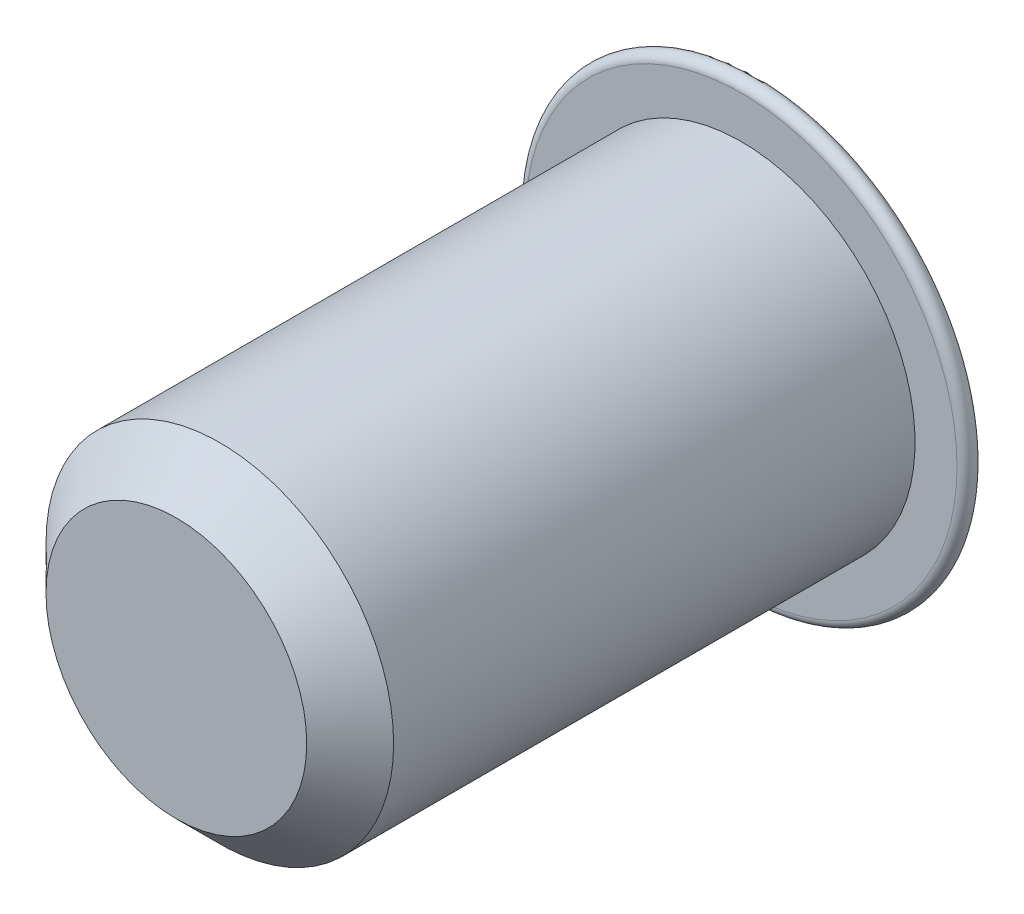
from build123d import *

# Parameters (mm, degrees)
CONG_1_R                = 0.1
CHANFREIN1_SIZE         = 0.5
ESQUISSE4_W             = 0.574782946
ESQUISSE4_H             = 1.352018642
ENL_V_MAT_EXTRU_1_DEPTH = 10


with BuildPart() as part:
    # Esquisse1 → Révolution1 (revolve)
    with BuildSketch(Plane(origin=(0, 0, 0), x_dir=(1, 0, 0), z_dir=(0, 1, 0))):
        with BuildLine():
            Line((0, 0), (0, 6.5))
            Line((0, 6.5), (-1, 6.5))
            add(Edge.make_bspline(
                [(-1, 6.5), (0, 7), (2, 7)],
                knots=[0, 0, 0, 1, 1, 1], degree=2))
            Line((2, 7), (2, 0))
            Line((2, 0), (0, 0))
        make_face()
    revolve(axis=Axis((2, 0, -7), (0, 0, 1)))

    # Congé1
    cong_1_edges = [part.edges().sort_by_distance(p)[0] for p in [
        (5, 0, -6.5),
    ]]
    fillet(cong_1_edges, radius=CONG_1_R)

    # Chanfrein1
    chanfrein1_edges = [part.edges().sort_by_distance(p)[0] for p in [
        (4, 0, 0),
    ]]
    chamfer(chanfrein1_edges, length=CHANFREIN1_SIZE)

    # Esquisse4 → Enlèv. mat.-Extru.1 (cut, symmetric)
    with BuildSketch(Plane(origin=(0.478013725, -0.852953884, 0), x_dir=(-0.8723492061003342, -0.4888832811787661, 0), z_dir=(-0.48888328117876617, 0.8723492061003343, 0))):
        with Locations((-1.744698412, -7.456425035)):
            Rectangle(ESQUISSE4_W, ESQUISSE4_H)
    extrude(amount=ENL_V_MAT_EXTRU_1_DEPTH, both=True, mode=Mode.SUBTRACT)


solid = part.part
